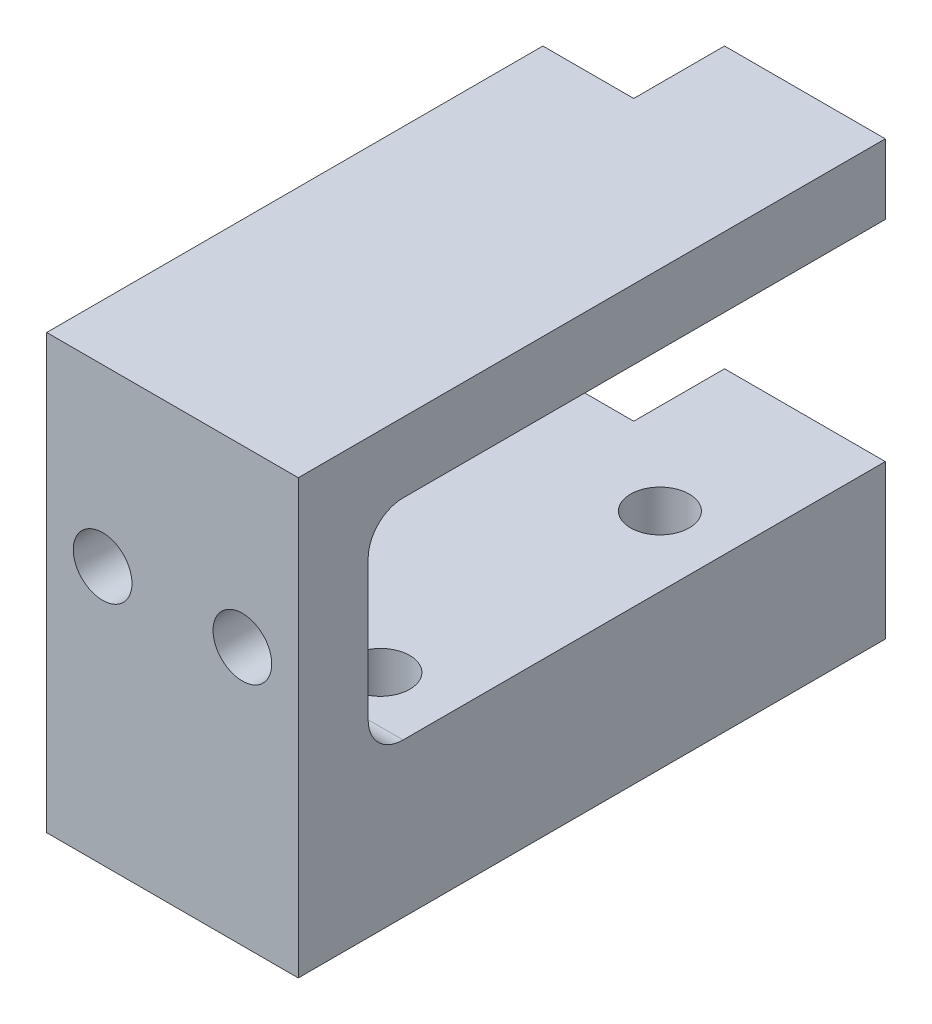
from build123d import *

# Parameters (mm, degrees)
SKETCH1_W                                  = 18
SKETCH1_H                                  = 20
BOSS_EXTRUDE1_DEPTH                        = 2.5
SKETCH2_W                                  = 18
SKETCH2_H                                  = 5
BOSS_EXTRUDE2_DEPTH                        = 42
SKETCH7_W                                  = 18
SKETCH7_H                                  = 5
BOSS_EXTRUDE3_DEPTH                        = 42
CSK_FOR_M3_HEX_SOCKET_COUNTERSUNK_CAP_SC_D = 4.2
SKETCH10_W                                 = 18
SKETCH10_H                                 = 42
BOSS_EXTRUDE4_DEPTH                        = 6
SKETCH9_W                                  = 6.5
SKETCH9_H                                  = 6.5
CUT_EXTRUDE2_DEPTH                         = 52.01225343
TAPPED_HOLE_FOR_M4X0_7_HELICOIL1_D         = 4.2
TAPPED_HOLE_FOR_M4X0_7_HELICOIL1_DEPTH     = 11
SKETCH11_R                                 = 2
CUT_EXTRUDE3_DEPTH                         = 6
FILLET1_R                                  = 2.5


with BuildPart() as part:
    # Sketch1 → Boss-Extrude1 (new, symmetric)
    with BuildSketch(Plane.XY):
        Rectangle(SKETCH1_W, SKETCH1_H)
    extrude(amount=BOSS_EXTRUDE1_DEPTH, both=True)

    # Sketch2 → Boss-Extrude2 (add)
    with BuildSketch(Plane(origin=(0, 0, 2.5), x_dir=(-1, 0, 0), z_dir=(0, 0, -1))):
        with Locations((0, -7.5)):
            Rectangle(SKETCH2_W, SKETCH2_H)
    extrude(amount=BOSS_EXTRUDE2_DEPTH)

    # Sketch7 → Boss-Extrude3 (add)
    with BuildSketch(Plane.XY.offset(2.5)):
        with Locations((0, 12.5)):
            Rectangle(SKETCH7_W, SKETCH7_H)
    extrude(amount=-BOSS_EXTRUDE3_DEPTH)

    # CSK for M3 Hex Socket Countersunk Cap Screw1 (through all)
    with Locations(Plane.XY.offset(2.5)):
        with Locations((-5, 2.5), (5, 2.5)):
            Hole(CSK_FOR_M3_HEX_SOCKET_COUNTERSUNK_CAP_SC_D / 2)

    # Sketch10 → Boss-Extrude4 (add)
    with BuildSketch(Plane.XZ.offset(10)):
        with Locations((0, -18.5)):
            Rectangle(SKETCH10_W, SKETCH10_H)
    extrude(amount=BOSS_EXTRUDE4_DEPTH)

    # Sketch9 → Cut-Extrude2 (cut, through all)
    with BuildSketch(Plane.XZ.offset(16)):
        with Locations((-5.75, -36.25)):
            Rectangle(SKETCH9_W, SKETCH9_H)
    extrude(amount=-CUT_EXTRUDE2_DEPTH, mode=Mode.SUBTRACT)

    # Tapped Hole for M4x0.7 Helicoil1
    with Locations(Plane(origin=(0, -16, 0), x_dir=(-1, 0, 0), z_dir=(0, -1, 0))):
        with Locations((-4, 28.375), (-4, 8.375)):
            Hole(TAPPED_HOLE_FOR_M4X0_7_HELICOIL1_D / 2, depth=TAPPED_HOLE_FOR_M4X0_7_HELICOIL1_DEPTH)

    # Sketch11 → Cut-Extrude3 (cut)
    with BuildSketch(Plane(origin=(0, -16, 0), x_dir=(-1, 0, 0), z_dir=(0, -1, 0))):
        with Locations(Location((4, 8.375, 0), (0, 0, 90))):
            Circle(SKETCH11_R)
    extrude(amount=-CUT_EXTRUDE3_DEPTH, mode=Mode.SUBTRACT)

    # Fillet1
    fillet1_edges = [part.edges().sort_by_distance(p)[0] for p in [
        (0, -5, -2.5),
        (0, 10, -2.5),
    ]]
    fillet(fillet1_edges, radius=FILLET1_R)


solid = part.part
